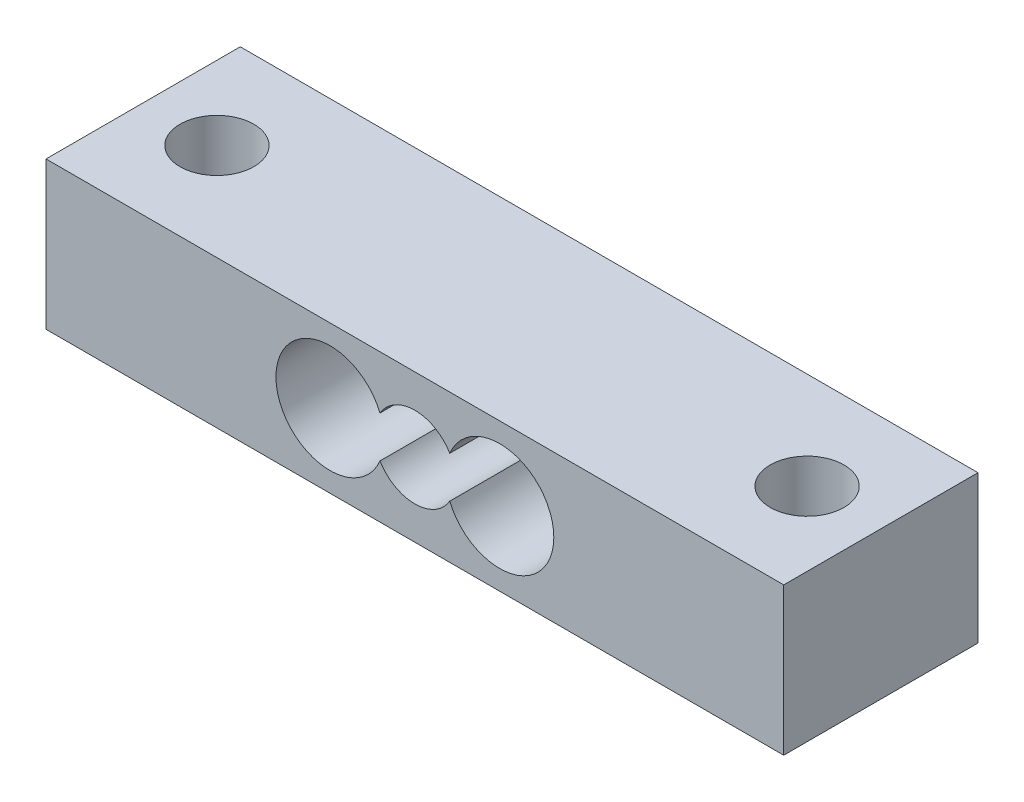
from build123d import *

# Parameters (mm, degrees)
SKETCH1_W           = 30
SKETCH1_H           = 6
BOSS_EXTRUDE1_DEPTH = 7.9
SKETCH2_R           = 1.5
CUT_EXTRUDE1_DEPTH  = 32.597626493


with BuildPart() as part:
    # Sketch1 → Boss-Extrude1 (new body)
    with BuildSketch(Plane.XY):
        with Locations((15, 3)):
            Rectangle(SKETCH1_W, SKETCH1_H)
        with BuildLine():
            ThreePointArc((13.581884058, 3.843473281), (9.35, 3), (13.581884058, 2.156526719))
            ThreePointArc((13.581884058, 2.156526719), (15, 1.35), (16.418115942, 2.156526719))
            ThreePointArc((16.418115942, 2.156526719), (20.65, 3), (16.418115942, 3.843473281))
            ThreePointArc((16.418115942, 3.843473281), (15, 4.65), (13.581884058, 3.843473281))
        make_face(mode=Mode.SUBTRACT)
    extrude(amount=BOSS_EXTRUDE1_DEPTH)

    # Sketch2 → Cut-Extrude1 (cut, through all)
    with BuildSketch(Plane(origin=(0, 6, 0), x_dir=(1, 0, 0), z_dir=(0, 1, 0))):
        with Locations(Location((3, -3.95, 0), (0, 0, 270))):
            Circle(SKETCH2_R)
        with Locations(Location((27, -3.95, 0), (0, 0, 270))):
            Circle(SKETCH2_R)
    extrude(amount=-CUT_EXTRUDE1_DEPTH, mode=Mode.SUBTRACT)


solid = part.part
